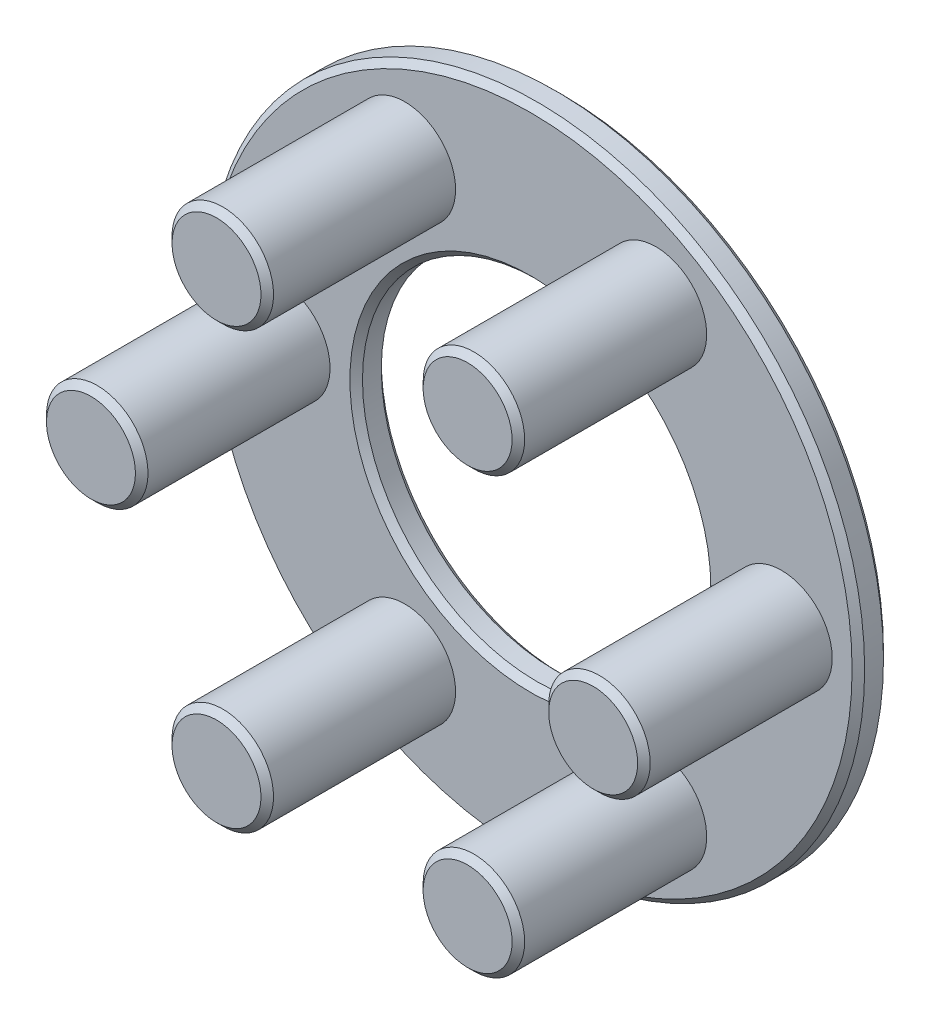
from build123d import *

# Parameters (mm, degrees)
SKETCH1_R           = 31.35
SKETCH1_R_2         = 16.65
BOSS_EXTRUDE1_DEPTH = 3
SKETCH2_R           = 4.85
BOSS_EXTRUDE2_DEPTH = 18
CIRPATTERN1_COUNT   = 6
CHAMFER1_SIZE       = 0.6
SCALE1_SCALE        = 0.4


with BuildPart() as part:
    # Sketch1 → Boss-Extrude1 (new body)
    with BuildSketch(Plane.XY):
        Circle(SKETCH1_R)
        Circle(SKETCH1_R_2, mode=Mode.SUBTRACT)
    extrude(amount=-BOSS_EXTRUDE1_DEPTH)

    # Sketch2 → Boss-Extrude2 (add)
    with BuildSketch(Plane.XY):
        with Locations((24, 0)):
            Circle(SKETCH2_R)
    boss_extrude2 = extrude(amount=BOSS_EXTRUDE2_DEPTH)

    # CirPattern1: Boss-Extrude2 ×6 about axis
    cirpattern1_axis = Axis((0, 0, 0), (0, 0, 1))
    for i in range(1, CIRPATTERN1_COUNT):
        add(boss_extrude2.rotate(cirpattern1_axis, i * 360 / CIRPATTERN1_COUNT))

    # Chamfer1
    chamfer1_edges = [part.edges().sort_by_distance(p)[0] for p in [
        (19.15, 0, 18),
        (9.575, -16.584386482, 18),
        (-9.575, -16.584386482, 18),
        (-31.35, 0, 0),
        (-19.15, 0, 18),
        (-9.575, 16.584386482, 18),
        (9.575, 16.584386482, 18),
        (-31.35, 0, -3),
        (-16.65, 0, -3),
        (-16.65, 0, 0),
    ]]
    chamfer(chamfer1_edges, length=CHAMFER1_SIZE)


with BuildPart() as part_1:
    # Scale1: scaled about (0, 0, 4.240913614)
    add(part.part.scale(SCALE1_SCALE).moved(Location((0, 0, 2.544548168))))


solid = part_1.part
